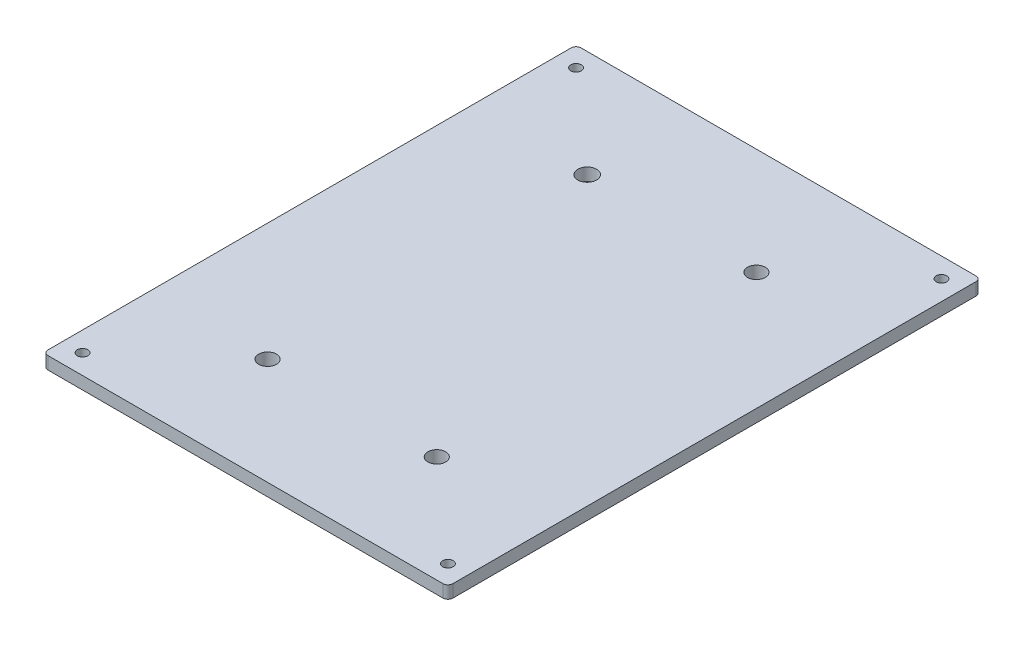
from build123d import *

# Parameters (mm, degrees)
SKETCH1_W           = 205.1
SKETCH1_H           = 270
BOSS_EXTRUDE1_DEPTH = 6.35
CUT_EXTRUDE2_REACH  = 171.652
SKETCH3_R           = 2.665
CUT_EXTRUDE3_REACH  = 171.652
SKETCH2_R           = 4.7625
SKETCH2_R_2         = 4.5
FILLET1_R           = 2.54


with BuildPart() as part:
    # Sketch1 → Boss-Extrude1 (new body)
    with BuildSketch(Plane(origin=(0, 0, 0), x_dir=(1, 0, 0), z_dir=(0, 1, 0))):
        Rectangle(SKETCH1_W, SKETCH1_H)
    extrude(amount=BOSS_EXTRUDE1_DEPTH)

    # Sketch3 → Cut-Extrude2 (cut, up to next)
    with BuildSketch(Plane(origin=(0, 6.35, 0), x_dir=(-1, 0, 0), z_dir=(0, 1, 0)), mode=Mode.PRIVATE) as cut_extrude2_sk1:
        with Locations(Location((92.55, 125, 0), (0, 0, 90))):
            Circle(SKETCH3_R)
    cut_extrude2_tool1 = extrude(cut_extrude2_sk1.sketch, amount=-CUT_EXTRUDE2_REACH, mode=Mode.PRIVATE) & part.part
    # Sketch3 → Cut-Extrude2 (cut, up to next)
    with BuildSketch(Plane(origin=(0, 6.35, 0), x_dir=(-1, 0, 0), z_dir=(0, 1, 0)), mode=Mode.PRIVATE) as cut_extrude2_sk2:
        with Locations(Location((-92.55, 125, 0), (0, 0, 90))):
            Circle(SKETCH3_R)
    cut_extrude2_tool2 = extrude(cut_extrude2_sk2.sketch, amount=-CUT_EXTRUDE2_REACH, mode=Mode.PRIVATE) & part.part
    # Sketch3 → Cut-Extrude2 (cut, up to next)
    with BuildSketch(Plane(origin=(0, 6.35, 0), x_dir=(-1, 0, 0), z_dir=(0, 1, 0)), mode=Mode.PRIVATE) as cut_extrude2_sk3:
        with Locations(Location((-92.55, -125, 0), (0, 0, 90))):
            Circle(SKETCH3_R)
    cut_extrude2_tool3 = extrude(cut_extrude2_sk3.sketch, amount=-CUT_EXTRUDE2_REACH, mode=Mode.PRIVATE) & part.part
    # Sketch3 → Cut-Extrude2 (cut, up to next)
    with BuildSketch(Plane(origin=(0, 6.35, 0), x_dir=(-1, 0, 0), z_dir=(0, 1, 0)), mode=Mode.PRIVATE) as cut_extrude2_sk4:
        with Locations(Location((92.55, -125, 0), (0, 0, 90))):
            Circle(SKETCH3_R)
    cut_extrude2_tool4 = extrude(cut_extrude2_sk4.sketch, amount=-CUT_EXTRUDE2_REACH, mode=Mode.PRIVATE) & part.part
    add(cut_extrude2_tool1.solids().sort_by_distance((-92.55, 6.35, 125))[0], mode=Mode.SUBTRACT)
    add(cut_extrude2_tool2.solids().sort_by_distance((92.55, 6.35, 125))[0], mode=Mode.SUBTRACT)
    add(cut_extrude2_tool3.solids().sort_by_distance((92.55, 6.35, -125))[0], mode=Mode.SUBTRACT)
    add(cut_extrude2_tool4.solids().sort_by_distance((-92.55, 6.35, -125))[0], mode=Mode.SUBTRACT)

    # Sketch2 → Cut-Extrude3 (cut, up to next)
    with BuildSketch(Plane(origin=(0, 6.35, 0), x_dir=(1, 0, 0), z_dir=(0, 1, 0)), mode=Mode.PRIVATE) as cut_extrude3_sk1:
        with Locations(Location((-42.8625, 80.9625, 0), (0, 0, 270))):
            Circle(SKETCH2_R)
    cut_extrude3_tool1 = extrude(cut_extrude3_sk1.sketch, amount=-CUT_EXTRUDE3_REACH, mode=Mode.PRIVATE) & part.part
    # Sketch2 → Cut-Extrude3 (cut, up to next)
    with BuildSketch(Plane(origin=(0, 6.35, 0), x_dir=(1, 0, 0), z_dir=(0, 1, 0)), mode=Mode.PRIVATE) as cut_extrude3_sk2:
        with Locations(Location((-42.8625, -80.9625, 0), (0, 0, 270))):
            Circle(SKETCH2_R_2)
    cut_extrude3_tool2 = extrude(cut_extrude3_sk2.sketch, amount=-CUT_EXTRUDE3_REACH, mode=Mode.PRIVATE) & part.part
    # Sketch2 → Cut-Extrude3 (cut, up to next)
    with BuildSketch(Plane(origin=(0, 6.35, 0), x_dir=(1, 0, 0), z_dir=(0, 1, 0)), mode=Mode.PRIVATE) as cut_extrude3_sk3:
        with Locations(Location((42.8625, -80.9625, 0), (0, 0, 270))):
            Circle(SKETCH2_R_2)
    cut_extrude3_tool3 = extrude(cut_extrude3_sk3.sketch, amount=-CUT_EXTRUDE3_REACH, mode=Mode.PRIVATE) & part.part
    # Sketch2 → Cut-Extrude3 (cut, up to next)
    with BuildSketch(Plane(origin=(0, 6.35, 0), x_dir=(1, 0, 0), z_dir=(0, 1, 0)), mode=Mode.PRIVATE) as cut_extrude3_sk4:
        with Locations(Location((42.8625, 80.9625, 0), (0, 0, 270))):
            Circle(SKETCH2_R_2)
    cut_extrude3_tool4 = extrude(cut_extrude3_sk4.sketch, amount=-CUT_EXTRUDE3_REACH, mode=Mode.PRIVATE) & part.part
    add(cut_extrude3_tool1.solids().sort_by_distance((-42.8625, 6.35, -80.9625))[0], mode=Mode.SUBTRACT)
    add(cut_extrude3_tool2.solids().sort_by_distance((-42.8625, 6.35, 80.9625))[0], mode=Mode.SUBTRACT)
    add(cut_extrude3_tool3.solids().sort_by_distance((42.8625, 6.35, 80.9625))[0], mode=Mode.SUBTRACT)
    add(cut_extrude3_tool4.solids().sort_by_distance((42.8625, 6.35, -80.9625))[0], mode=Mode.SUBTRACT)

    # Fillet1
    fillet1_edges = [part.edges().sort_by_distance(p)[0] for p in [
        (-102.55, 3.175, -135),
        (102.55, 3.175, -135),
        (102.55, 3.175, 135),
        (-102.55, 3.175, 135),
    ]]
    fillet(fillet1_edges, radius=FILLET1_R)


solid = part.part
